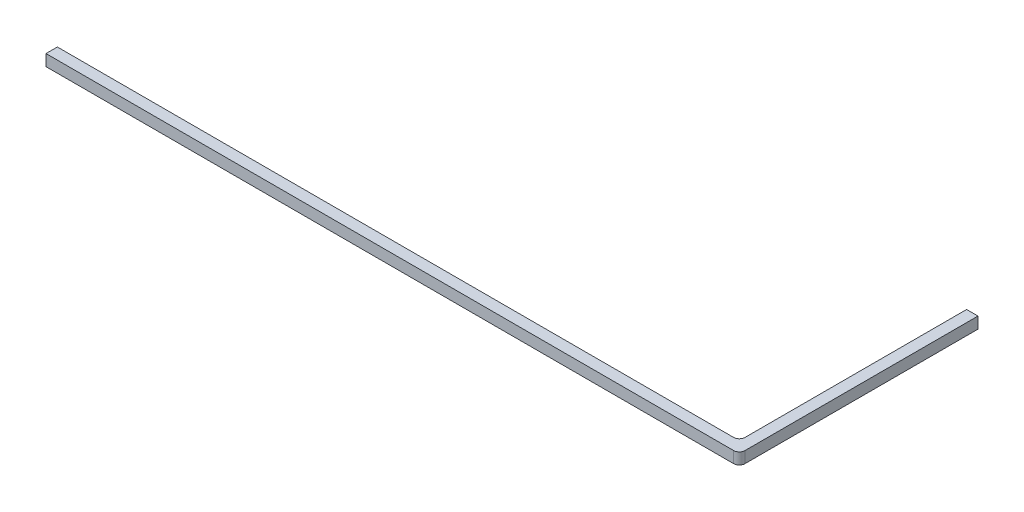
from build123d import *

# Parameters (mm, degrees)
EXTRUDE_1_DEPTH = 10
FILLET_1_R      = 5
FILLET_2_R      = 5


with BuildPart() as part:
    # 草图1 → 凸台-拉伸1 (new body)
    with BuildSketch(Plane(origin=(0, 0, 0), x_dir=(1, 0, 0), z_dir=(0, 1, 0))):
        Polygon((0, 0), (600, 0), (600, 200), (610, 200), (610, -10), (600, -10), (0, -10), align=None)
    extrude(amount=EXTRUDE_1_DEPTH)

    # 圆角1
    fillet_1_edges = [part.edges().sort_by_distance(p)[0] for p in [
        (600, 5, 0),
    ]]
    fillet(fillet_1_edges, radius=FILLET_1_R)

    # 圆角2
    fillet_2_edges = [part.edges().sort_by_distance(p)[0] for p in [
        (610, 5, 10),
    ]]
    fillet(fillet_2_edges, radius=FILLET_2_R)


solid = part.part
